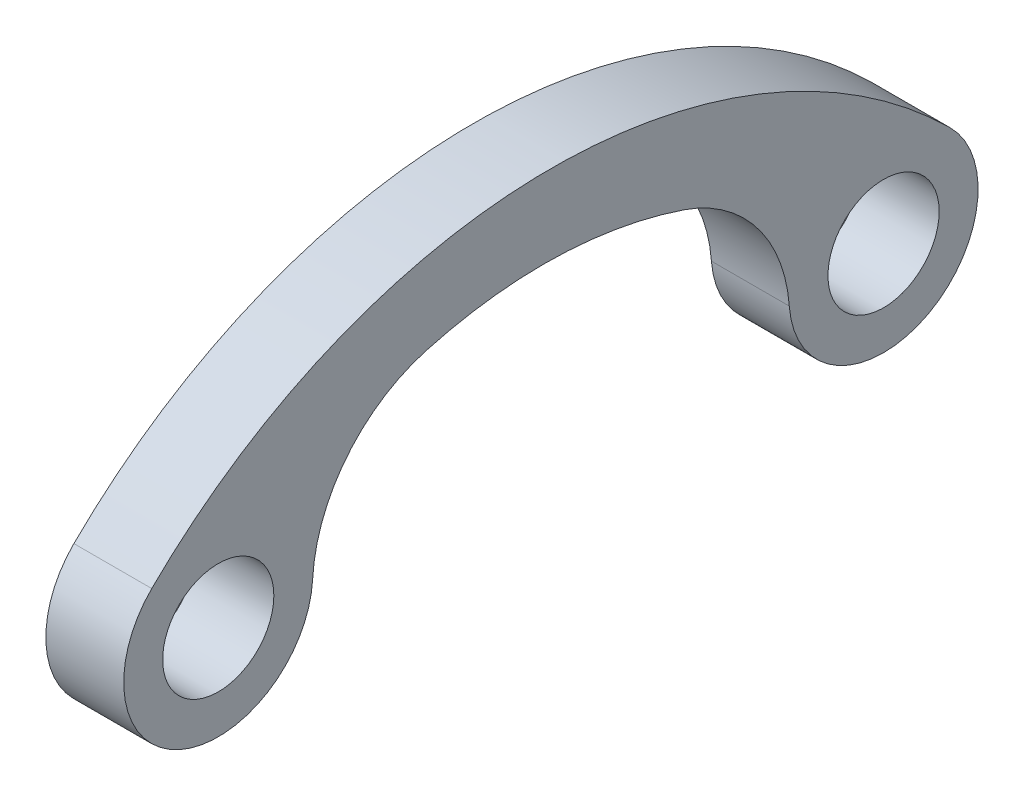
from build123d import *

# Parameters (mm, degrees)
SKETCH1_R           = 3.57
BOSS_EXTRUDE1_DEPTH = 5


with BuildPart() as part:
    # Sketch1 → Boss-Extrude1 (new body)
    with BuildSketch(Plane(origin=(0, 0, 0), x_dir=(0, 0, -1), z_dir=(1, 0, 0))):
        with BuildLine():
            ThreePointArc((4.27020031, 4.313964454), (-21.36, 14.853878163), (-46.99020031, 4.313964454))
            ThreePointArc((-46.99020031, 4.313964454), (-45.212525236, -5.534638014), (-36.65944536, -0.338492916))
            ThreePointArc((-36.65944536, -0.338492916), (-34.472469129, 5.364814131), (-29.3762145, 8.732122411))
            ThreePointArc((-29.3762145, 8.732122411), (-21.056615852, 9.761945239), (-12.805336851, 8.281184769))
            ThreePointArc((-12.805336851, 8.281184769), (-8.116246419, 4.932321146), (-6.05344864, -0.447950405))
            ThreePointArc((-6.05344864, -0.447950405), (2.54243032, -5.511891514), (4.27020031, 4.313964454))
        make_face()
        Circle(SKETCH1_R, mode=Mode.SUBTRACT)
        with Locations((-42.72, 0)):
            Circle(SKETCH1_R, mode=Mode.SUBTRACT)
    extrude(amount=BOSS_EXTRUDE1_DEPTH)


solid = part.part
